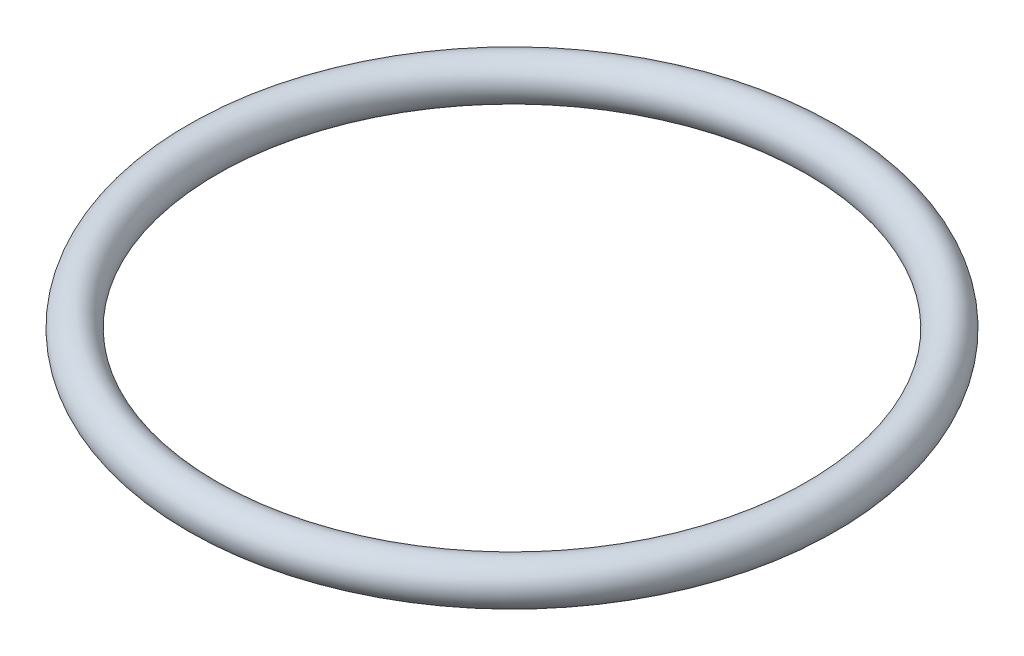
from build123d import *

# Parameters (mm, degrees)
SKETCH_1_R = 7


with BuildPart() as part:
    # 草图1 → 旋转1 (revolve)
    with BuildSketch(Plane.XY, mode=Mode.PRIVATE) as revolve_1_sk:
        Circle(SKETCH_1_R)
    revolve(revolve_1_sk.sketch.rotate(Axis((107, 0, 0), (0, 1, 0)), 270), axis=Axis((107, 0, 0), (0, 1, 0)))


solid = part.part
